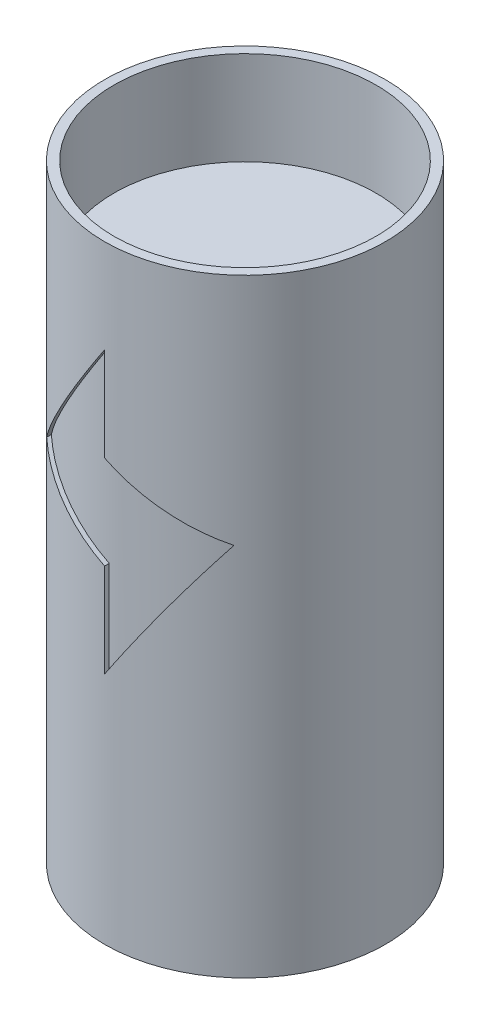
from build123d import *

# Parameters (mm, degrees)
SKETCH1_R                   = 60
MAIN_EXTRUDE_DEPTH          = 260
SKETCH2_R                   = 56
HOLE_FOR_BLADE_CASING_DEPTH = 40
HOLE_START                  = -20
SKETCH3_R                   = 56
HOLE_TO_HIDE_LEGS_DEPTH     = 20
LIGHTNING_BOLT_REACH        = 296.575
LIGHTNING_BOLT_START_RADIUS = 60
LIGHTNING_BOLT_END_RADIUS   = 60
SKETCH5_R                   = 16
LEGS_DEPTH                  = 19


with BuildPart() as part:
    # Sketch1 → Main Extrude (new body)
    with BuildSketch(Plane(origin=(0, 0, 0), x_dir=(1, 0, 0), z_dir=(0, 1, 0))):
        with Locations(Location((0, 0, 0), (0, 0, 270))):
            Circle(SKETCH1_R)
    extrude(amount=MAIN_EXTRUDE_DEPTH)

    # Sketch2 → Hole for Blade Casing (cut)
    with BuildSketch(Plane(origin=(0, 260, 0), x_dir=(1, 0, 0), z_dir=(0, 1, 0))):
        with Locations(Location((0, 0, 0), (0, 0, 270))):
            Circle(SKETCH2_R)
    extrude(amount=-HOLE_FOR_BLADE_CASING_DEPTH, mode=Mode.SUBTRACT)

    # Sketch3 → Hole to Hide Legs (cut)
    with BuildSketch(Plane.XZ.offset(HOLE_START)):
        with Locations(Location((0, 0, 0), (0, 0, 90))):
            Circle(SKETCH3_R)
    extrude(amount=HOLE_TO_HIDE_LEGS_DEPTH, mode=Mode.SUBTRACT)

    # Lightning Bolt: from a cylinder face, 296.575 long prism both ways, kept between that surface and its translate by the depth
    lightning_bolt_start = Plane(origin=(0, 160, 0), z_dir=(0, -1, 0)) * Cylinder(LIGHTNING_BOLT_START_RADIUS, 714.15, mode=Mode.PRIVATE)
    lightning_bolt_end = Plane(origin=(0, 160, -2), z_dir=(0, -1, 0)) * Cylinder(LIGHTNING_BOLT_END_RADIUS, 714.15, mode=Mode.PRIVATE)
    # Sketch4 → Lightning Bolt (cut, from a surface)
    with BuildSketch(Plane.XY.offset(60), mode=Mode.PRIVATE) as lightning_bolt_sk1:
        Polygon((0, 220), (-40, 160), (0, 140), (0, 100), (40, 160), (0, 180), align=None)
    lightning_bolt_tool1 = extrude(lightning_bolt_sk1.sketch, amount=LIGHTNING_BOLT_REACH, both=True, mode=Mode.PRIVATE)
    add(((lightning_bolt_tool1 & lightning_bolt_start) - lightning_bolt_end).solids().sort_by_distance((0, 160, 51.36068))[0], mode=Mode.SUBTRACT)

    # Sketch5 → Legs (add)
    with BuildSketch(Plane.XZ.offset(-20)):
        with Locations(Location((-24.748737342, 24.748737342, 0), (0, 0, 270))):
            Circle(SKETCH5_R)
        with Locations(Location((24.748737342, 24.748737342, 0), (0, 0, 270))):
            Circle(SKETCH5_R)
        with Locations(Location((24.748737342, -24.748737342, 0), (0, 0, 270))):
            Circle(SKETCH5_R)
        with Locations(Location((-24.748737342, -24.748737342, 0), (0, 0, 270))):
            Circle(SKETCH5_R)
    extrude(amount=LEGS_DEPTH)


solid = part.part
